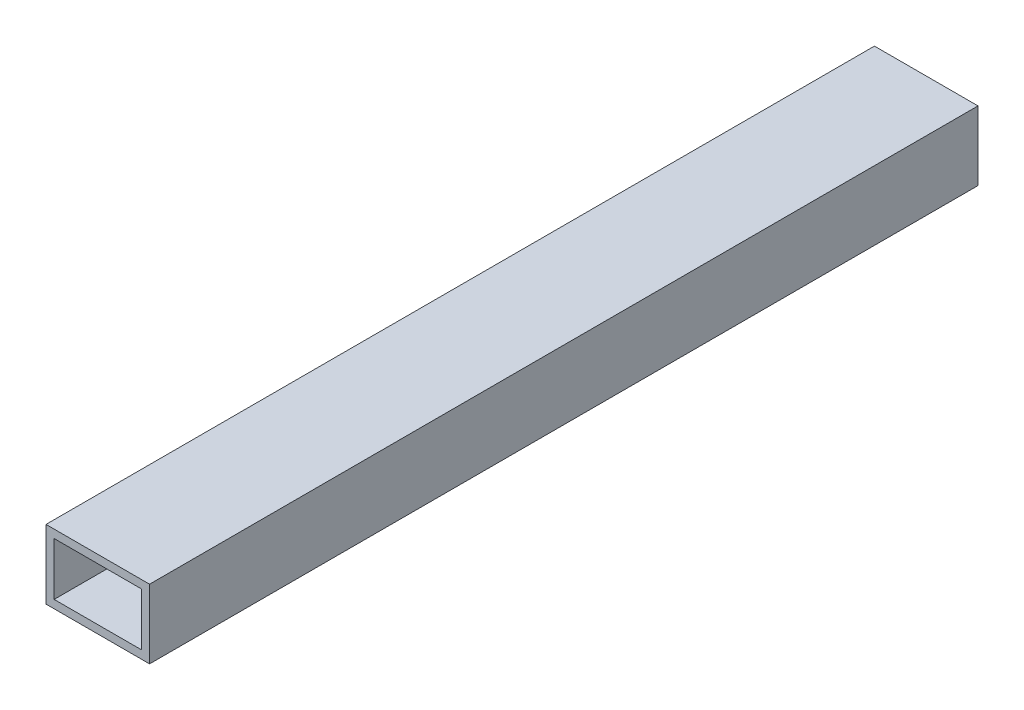
from build123d import *

# Parameters (mm, degrees)
SKETCH2_W           = 76.2
SKETCH2_H           = 50.8
SKETCH2_W_2         = 64.200000124
SKETCH2_H_2         = 38.800000124
BOSS_EXTRUDE1_DEPTH = 609.6


with BuildPart() as part:
    # Sketch2 → Boss-Extrude1 (new body)
    with BuildSketch(Plane.XY):
        Rectangle(SKETCH2_W, SKETCH2_H)
        Rectangle(SKETCH2_W_2, SKETCH2_H_2, mode=Mode.SUBTRACT)
    extrude(amount=BOSS_EXTRUDE1_DEPTH)


solid = part.part
